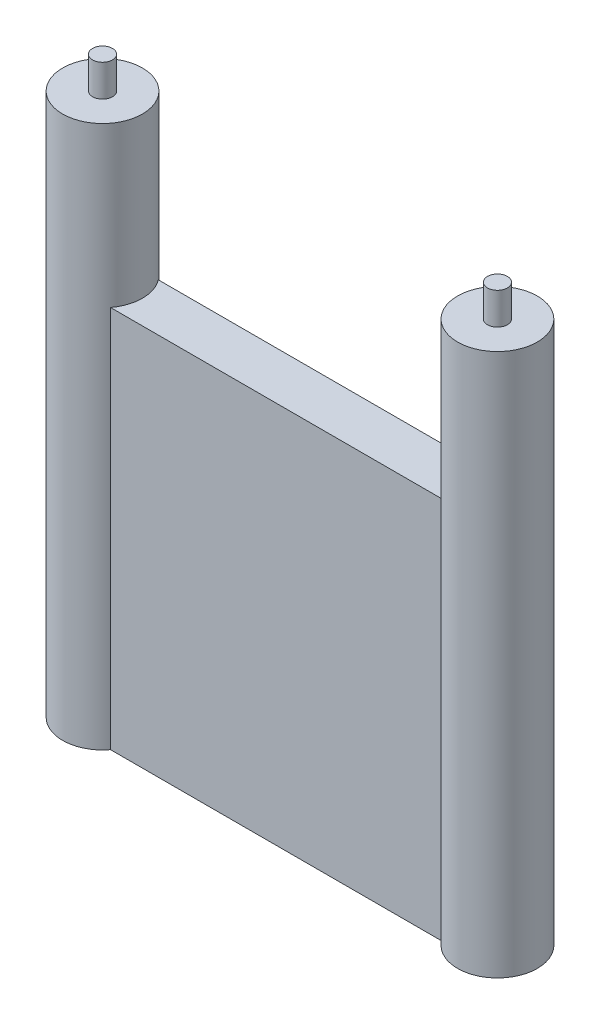
from build123d import *

# Parameters (mm, degrees)
SKETCH1_R           = 5
SKETCH1_W           = 49.5
SKETCH1_H           = 6
BOSS_EXTRUDE2_DEPTH = 68
SKETCH2_R           = 1.25
BOSS_EXTRUDE3_DEPTH = 4
CUT_EXTRUDE1_START  = -20
SKETCH3_W           = 77.654098362
SKETCH3_H           = 40.574365012
SKETCH3_R           = 5
CUT_EXTRUDE1_DEPTH  = 20


with BuildPart() as part:
    # Sketch1 → Boss-Extrude2 (new body)
    with BuildSketch(Plane(origin=(0, 0, 0), x_dir=(1, 0, 0), z_dir=(0, 1, 0))):
        Circle(SKETCH1_R)
        with Locations((-49.5, 0)):
            Circle(SKETCH1_R)
        with Locations((-24.75, 0)):
            Rectangle(SKETCH1_W, SKETCH1_H)
    extrude(amount=BOSS_EXTRUDE2_DEPTH)

    # Sketch2 → Boss-Extrude3 (add)
    with BuildSketch(Plane(origin=(0, 68, 0), x_dir=(1, 0, 0), z_dir=(0, 1, 0))):
        with Locations(Location((0, 0, 0), (0, 0, 270))):
            Circle(SKETCH2_R)
        with Locations(Location((-49.5, 0, 0), (0, 0, 270))):
            Circle(SKETCH2_R)
    extrude(amount=BOSS_EXTRUDE3_DEPTH)

    # Sketch3 → Cut-Extrude1 (cut)
    with BuildSketch(Plane(origin=(0, 68, 0), x_dir=(1, 0, 0), z_dir=(0, 1, 0)).offset(CUT_EXTRUDE1_START)):
        with Locations((-24.75, -3)):
            Rectangle(SKETCH3_W, SKETCH3_H)
        with Locations(Location((-49.5, 0, 0), (0, 0, 36.869897646))):
            Circle(SKETCH3_R, mode=Mode.SUBTRACT)
        with Locations(Location((0, 0, 0), (0, 0, 143.130102354))):
            Circle(SKETCH3_R, mode=Mode.SUBTRACT)
    extrude(amount=CUT_EXTRUDE1_DEPTH, mode=Mode.SUBTRACT)


solid = part.part
